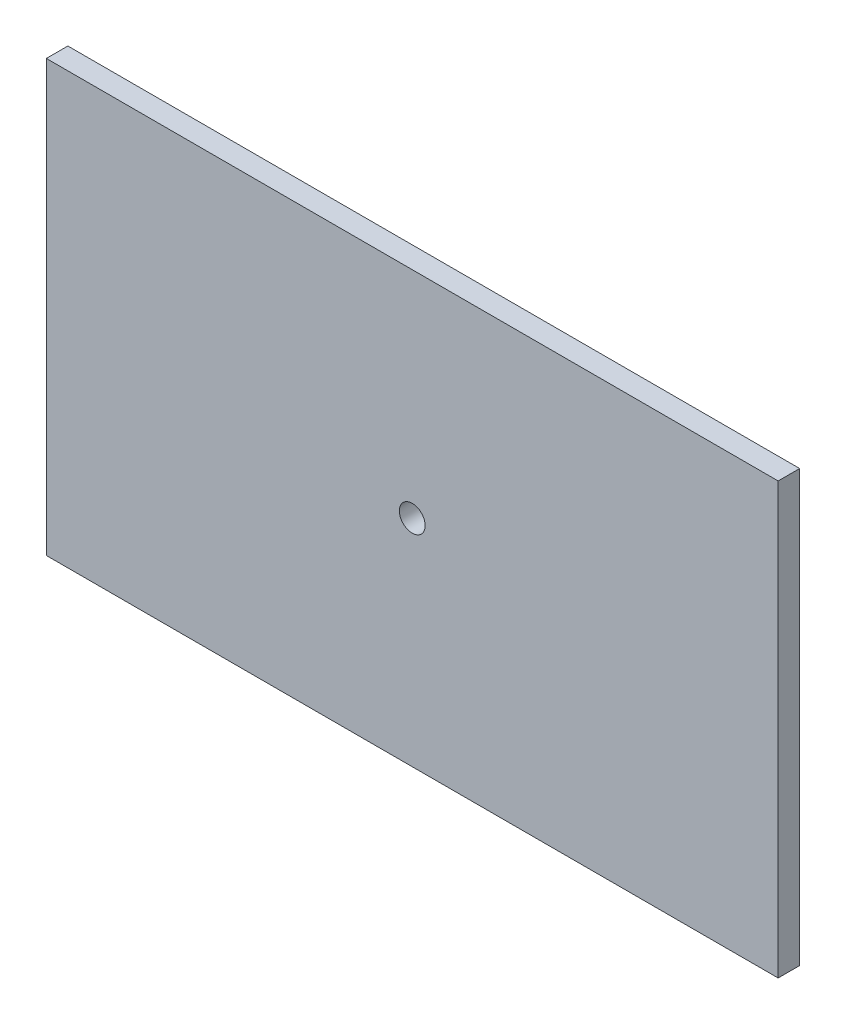
from build123d import *

# Parameters (mm, degrees)
SKETCH_1_W          = 340
SKETCH_1_H          = 200
EXTRUDE_1_DEPTH     = 10
SKETCH_2_R          = 6
CUT_EXTRUDE_1_DEPTH = 198.484176581


with BuildPart() as part:
    # 草图1 → 凸台-拉伸1 (new body)
    with BuildSketch(Plane.XY):
        Rectangle(SKETCH_1_W, SKETCH_1_H)
    extrude(amount=EXTRUDE_1_DEPTH)

    # 草图2 → 切除-拉伸1 (cut, through all)
    with BuildSketch(Plane.XY.offset(10)):
        Circle(SKETCH_2_R)
    extrude(amount=-CUT_EXTRUDE_1_DEPTH, mode=Mode.SUBTRACT)


solid = part.part
